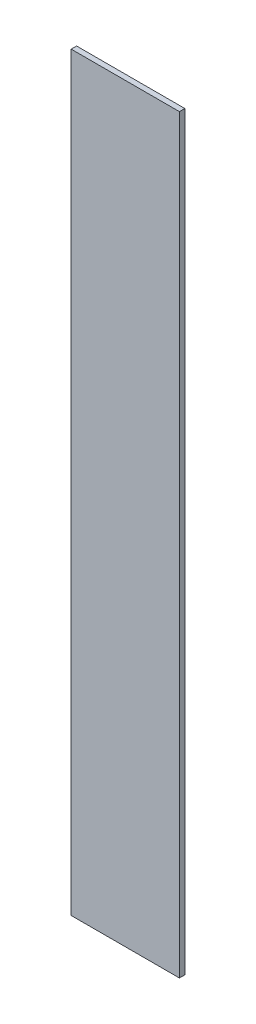
from build123d import *

# Parameters (mm, degrees)
ESQUISSE1_W        = 120
ESQUISSE1_H        = 832
BOSS_EXTRU_1_DEPTH = 6


with BuildPart() as part:
    # Esquisse1 → Boss.-Extru.1 (new body)
    with BuildSketch(Plane.XY):
        Rectangle(ESQUISSE1_W, ESQUISSE1_H)
    extrude(amount=BOSS_EXTRU_1_DEPTH)


solid = part.part
